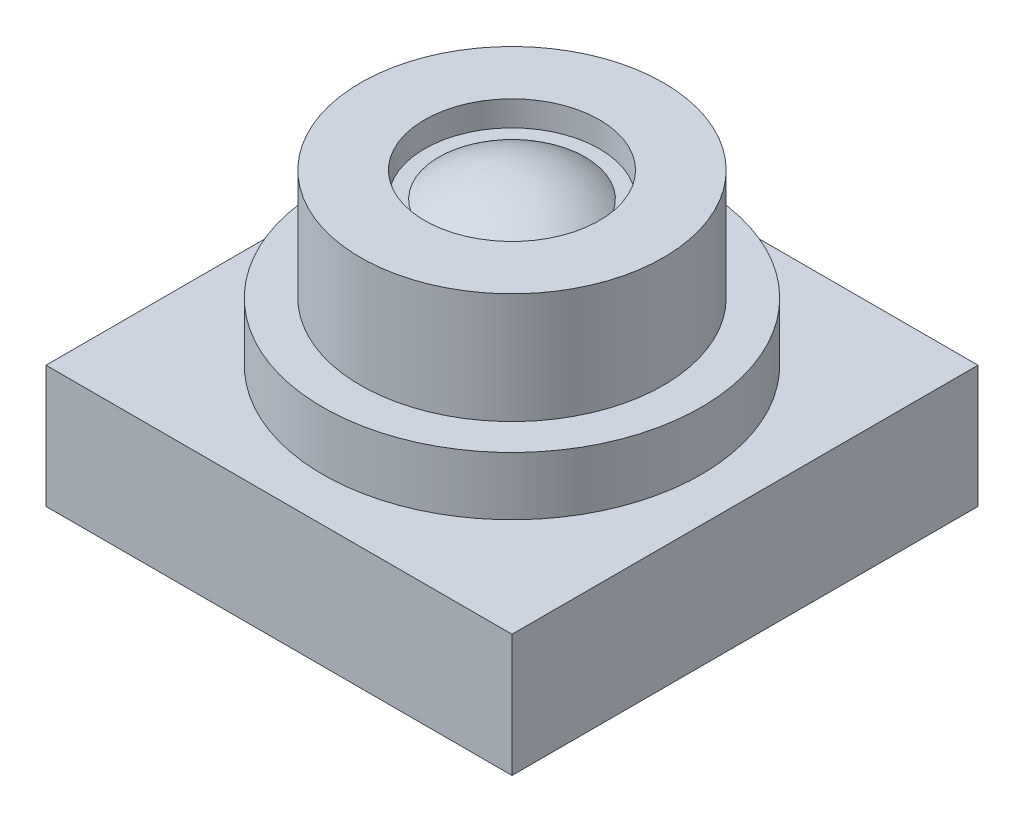
from build123d import *

# Parameters (mm, degrees)
SKETCH1_W           = 8
SKETCH1_H           = 8
BOSS_EXTRUDE1_DEPTH = 2.1


with BuildPart() as part:
    # Sketch1 → Boss-Extrude1 (new body)
    with BuildSketch(Plane(origin=(0, 0, 0), x_dir=(1, 0, 0), z_dir=(0, 1, 0))):
        Rectangle(SKETCH1_W, SKETCH1_H)
    extrude(amount=BOSS_EXTRUDE1_DEPTH)

    # Sketch2 → Revolve1 (revolve)
    with BuildSketch(Plane(origin=(0, 0, 0), x_dir=(0, 0, -1), z_dir=(1, 0, 0)), mode=Mode.PRIVATE) as revolve1_sk:
        with BuildLine():
            Line((-3.25, 2.1), (-3.25, 3.1))
            Line((-3.25, 3.1), (-2.6, 3.1))
            Line((-2.6, 3.1), (-2.6, 5))
            Line((-2.6, 5), (-1.5, 5))
            Line((-1.5, 5), (-1.5, 4.568074784))
            Line((-1.5, 4.568074784), (-1.255377615, 4.568074784))
            ThreePointArc((-1.255377615, 4.568074784), (-0.663801994, 4.888999279), (0, 5))
            Line((0, 5), (0, 2.1))
            Line((0, 2.1), (-3.25, 2.1))
        make_face()
    revolve(revolve1_sk.sketch.rotate(Axis((0, 0, 0), (0, 1, 0)), 180), axis=Axis((0, 0, 0), (0, 1, 0)))


solid = part.part
